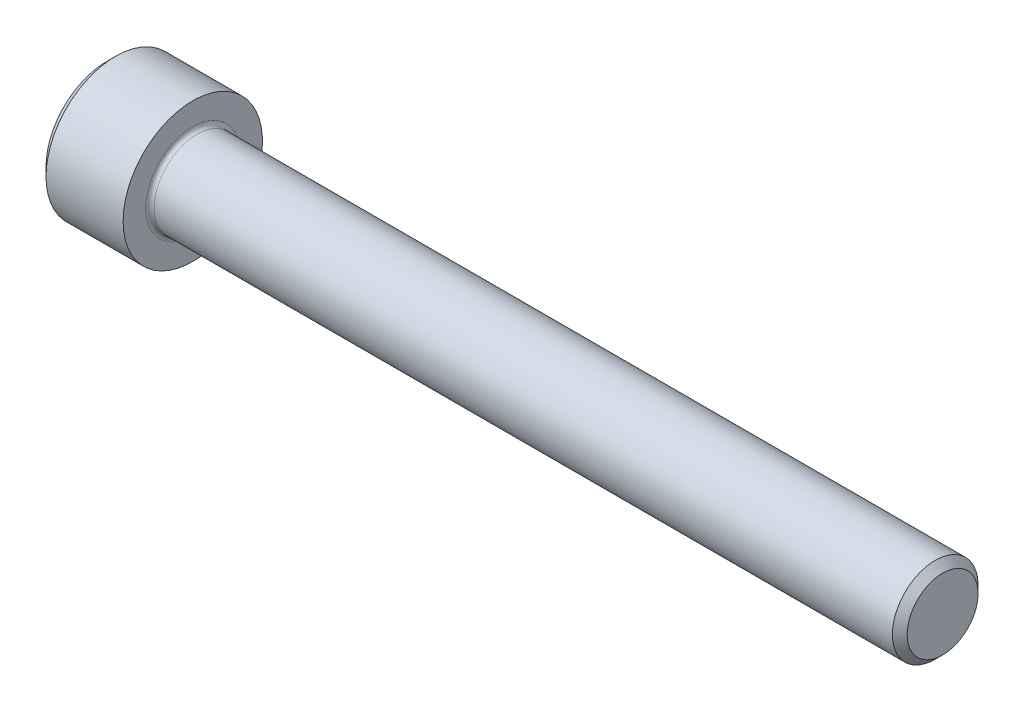
from build123d import *

# Parameters (mm, degrees)
FILLET1_R   = 0.4
HEX_2_DEPTH = 4


with BuildPart() as part:
    # BodySke → Base-Revolve (revolve)
    with BuildSketch(Plane.XY, mode=Mode.PRIVATE) as base_revolve_sk:
        Polygon((0, 0), (0, 5.7), (0.8, 6.5), (8, 6.5), (8, 4), (77.3095, 4), (78, 3.3095), (78, 0), align=None)
    revolve(base_revolve_sk.sketch.rotate(Axis((-31.75, 0, 0), (1, 0, 0)), 90), axis=Axis((-31.75, 0, 0), (1, 0, 0)))

    # Fillet1
    fillet1_edges = [part.edges().sort_by_distance(p)[0] for p in [
        (8, 0, -4),
    ]]
    fillet(fillet1_edges, radius=FILLET1_R)

    # Sketch2 → Hex-PreBroach (revolve, cut)
    with BuildSketch(Plane.XY, mode=Mode.PRIVATE) as hex_prebroach_sk:
        Polygon((0, 3.0475), (4, 3.0475), (5.759474945, 0), (0, 0), align=None)
    revolve(hex_prebroach_sk.sketch.rotate(Axis((0, 0, 0), (1, 0, 0)), 90), axis=Axis((0, 0, 0), (1, 0, 0)), mode=Mode.SUBTRACT)

    # Sketch3 → Hex 2 (cut)
    with BuildSketch(Plane(origin=(0, 0, 0), x_dir=(0, 0.500000000000001, 0.866025403784438), z_dir=(-1, 0, 0))):
        Polygon((1.759474945, 3.0475), (-1.759474945, 3.0475), (-3.518949891, 0), (-1.759474945, -3.0475), (1.759474945, -3.0475), (3.518949891, 0), align=None)
    extrude(amount=-HEX_2_DEPTH, mode=Mode.SUBTRACT)


solid = part.part
